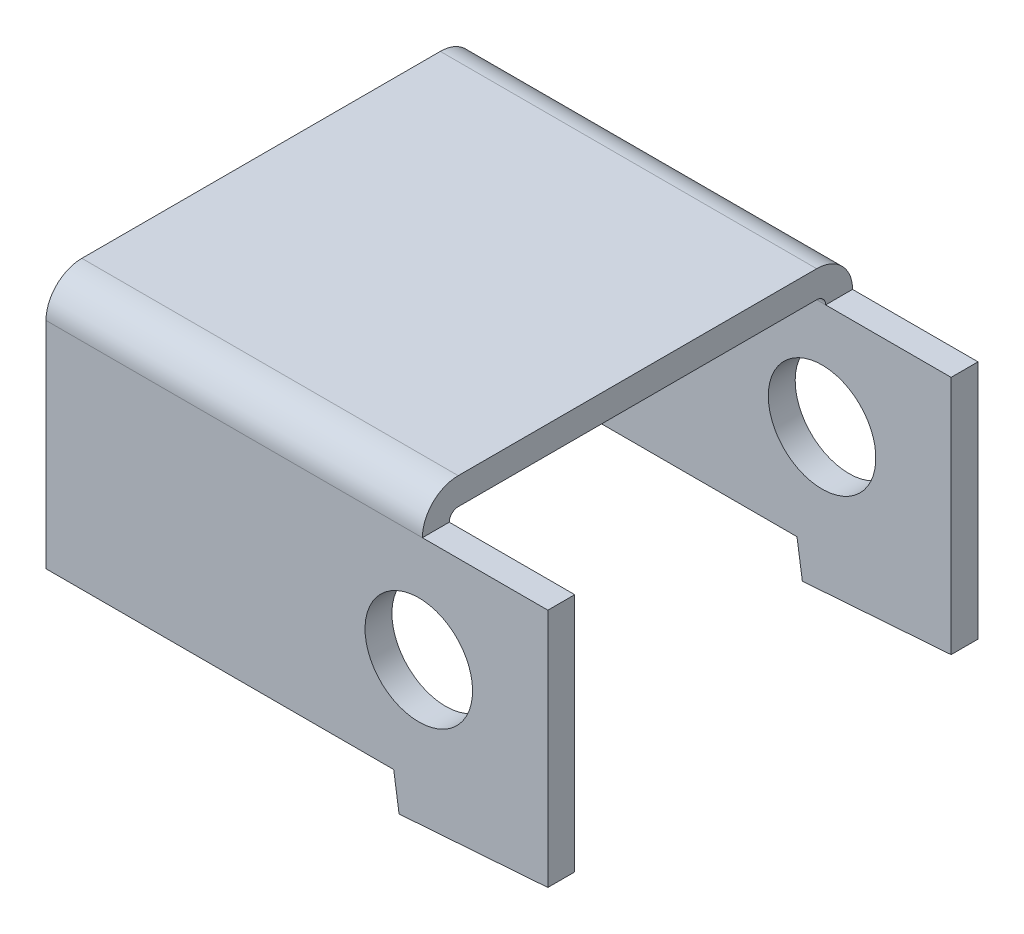
from build123d import *

# Parameters (mm, degrees)
SKETCH1_R               = 1.5
BOSS_EXTRUDE1_DEPTH     = 6
FILLET1_R               = 1
CUT_EXTRUDE2_DEPTH      = 13.655433616
CUT_EXTRUDE2_DEPTH_BACK = 13.655433616
CUT_EXTRUDE3_DEPTH      = 16.748015748
CUT_EXTRUDE3_DEPTH_BACK = 3.5


with BuildPart() as part:
    # Sketch1 → Boss-Extrude1 (new, symmetric)
    with BuildSketch(Plane.XY):
        Polygon((-10.4, -3), (-0.7, -3), (-0.55, -4), (3.6, -3.7), (3.6, 4), (-10.4, 4), align=None)
        Circle(SKETCH1_R, mode=Mode.SUBTRACT)
    extrude(amount=BOSS_EXTRUDE1_DEPTH, both=True)

    # Fillet1
    fillet1_edges = [part.edges().sort_by_distance(p)[0] for p in [
        (-3.4, 4, -6),
        (-3.4, 4, 6),
    ]]
    fillet(fillet1_edges, radius=FILLET1_R)

    # Sketch2 → Cut-Extrude2 (cut, two sides: drawn at the far end of the back side and taken through both)
    with BuildSketch(Plane(origin=(0, 0, 0), x_dir=(0, 0, -1), z_dir=(1, 0, 0)).offset(-CUT_EXTRUDE2_DEPTH_BACK)):
        with BuildLine():
            Line((-5.25, 3), (-5.25, -4))
            Line((-5.25, -4), (5.25, -4))
            Line((5.25, -4), (5.25, 3))
            ThreePointArc((5.25, 3), (5.176776695, 3.176776695), (5, 3.25))
            Line((5, 3.25), (-5, 3.25))
            ThreePointArc((-5, 3.25), (-5.176776695, 3.176776695), (-5.25, 3))
        make_face()
    extrude(amount=CUT_EXTRUDE2_DEPTH + CUT_EXTRUDE2_DEPTH_BACK, mode=Mode.SUBTRACT)

    # Sketch3 → Cut-Extrude3 (cut, two sides: drawn at the far end of the back side and taken through both)
    with BuildSketch(Plane(origin=(3.6, 0, 0), x_dir=(0, 0, -1), z_dir=(1, 0, 0)).offset(-CUT_EXTRUDE3_DEPTH_BACK)):
        with BuildLine():
            Line((-5, 4), (5, 4))
            ThreePointArc((5, 4), (5.707106781, 3.707106781), (6, 3))
            Line((6, 3), (-6, 3))
            ThreePointArc((-6, 3), (-5.707106781, 3.707106781), (-5, 4))
        make_face()
    extrude(amount=CUT_EXTRUDE3_DEPTH + CUT_EXTRUDE3_DEPTH_BACK, mode=Mode.SUBTRACT)


solid = part.part
